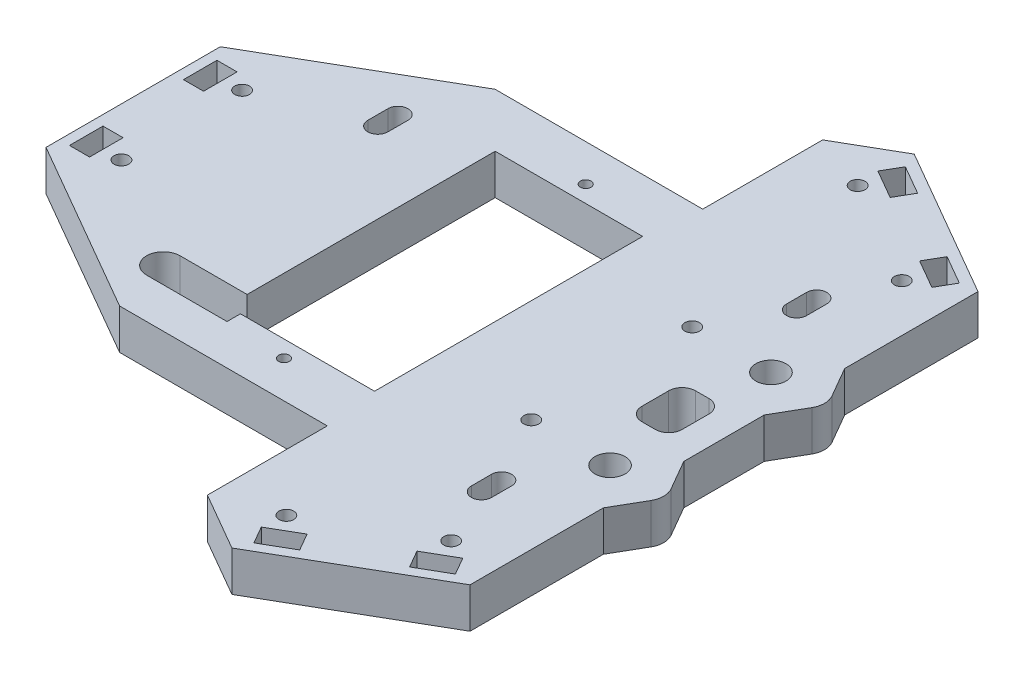
from build123d import *

# Parameters (mm, degrees)
SKETCH1_R                  = 1.1
SKETCH1_W                  = 3
SKETCH1_H                  = 5
SKETCH1_W_2                = 6
SKETCH1_H_2                = 8
BOSS_EXTRUDE1_DEPTH        = 6
F_1_6_1_6_DIAMETER_HOLE3_D = 1.6
BOSS_EXTRUDE2_DEPTH        = 6
FILLET1_R                  = 2
F_2_2_2_2_DIAMETER_HOLE1_D = 2.2
F_4_0MM_DOWEL_HOLE1_D      = 4.5


with BuildPart() as part:
    # Sketch1 → Boss-Extrude1 (new body)
    with BuildSketch(Plane(origin=(0, 0, 0), x_dir=(1, 0, 0), z_dir=(0, 1, 0))):
        Polygon((14.366669751, 50.883801944), (36.883330249, 37.883801944), (36.883330249, -37.883801944), (14.366669751, -50.883801944), (5.706415713, -45.883801944), (5.706415713, -28), (-25.269237886, -28), (-51.25, -13), (-51.25, 13), (-25.269237886, 28), (5.706415713, 28), (5.706415713, 45.883801944), align=None)
        with Locations(Location((14.205771366, 42.605117767, 0), (0, 0, 270))):
            Circle(SKETCH1_R, mode=Mode.SUBTRACT)
        with Locations(Location((29.794228634, 33.605117767, 0), (0, 0, 270))):
            Circle(SKETCH1_R, mode=Mode.SUBTRACT)
        with Locations(Location((29.794228634, -33.605117767, 0), (0, 0, 270))):
            Circle(SKETCH1_R, mode=Mode.SUBTRACT)
        with Locations(Location((14.205771366, -42.605117767, 0), (0, 0, 270))):
            Circle(SKETCH1_R, mode=Mode.SUBTRACT)
        with Locations(Location((-44, 9, 0), (0, 0, 270))):
            Circle(SKETCH1_R, mode=Mode.SUBTRACT)
        with Locations(Location((-44, -9, 0), (0, 0, 270))):
            Circle(SKETCH1_R, mode=Mode.SUBTRACT)
        with BuildLine():
            Line((4.75, -20), (-15.25, -20))
            Line((-15.25, -20), (-15.25, -22))
            Line((-15.25, -22), (-27.25, -22))
            ThreePointArc((-27.25, -22), (-29.75, -19.5), (-27.25, -17))
            Line((-27.25, -17), (-17.25, -17))
            Line((-17.25, -17), (-17.25, 20))
            Line((-17.25, 20), (4.75, 20))
            Line((4.75, 20), (4.75, -20))
        make_face(mode=Mode.SUBTRACT)
        Polygon((30.071152423, 40.084763838), (34.401279442, 37.584763838), (32.901279442, 34.986687627), (28.571152423, 37.486687627), align=None, mode=Mode.SUBTRACT)
        Polygon((15.348720558, 48.584763838), (13.848720558, 45.986687627), (18.178847577, 43.486687627), (19.678847577, 46.084763838), align=None, mode=Mode.SUBTRACT)
        Polygon((34.401279442, -37.584763838), (32.901279442, -34.986687627), (28.571152423, -37.486687627), (30.071152423, -40.084763838), align=None, mode=Mode.SUBTRACT)
        Polygon((18.178847577, -43.486687627), (19.678847577, -46.084763838), (15.348720558, -48.584763838), (13.848720558, -45.986687627), align=None, mode=Mode.SUBTRACT)
        with Locations((-48.25, -8.5)):
            Rectangle(SKETCH1_W, SKETCH1_H, mode=Mode.SUBTRACT)
        with Locations((-48.25, 8.5)):
            Rectangle(SKETCH1_W, SKETCH1_H, mode=Mode.SUBTRACT)
        with BuildLine():
            Line((-30.75, 14.5), (-30.75, 17.5))
            ThreePointArc((-30.75, 17.5), (-29.25, 19), (-27.75, 17.5))
            Line((-27.75, 17.5), (-27.75, 14.5))
            ThreePointArc((-27.75, 14.5), (-29.25, 13), (-30.75, 14.5))
        make_face(mode=Mode.SUBTRACT)
        with BuildLine():
            Line((24.206415713, -25), (24.206415713, -22))
            ThreePointArc((24.206415713, -22), (25.706415713, -20.5), (27.206415713, -22))
            Line((27.206415713, -22), (27.206415713, -25))
            ThreePointArc((27.206415713, -25), (25.706415713, -26.5), (24.206415713, -25))
        make_face(mode=Mode.SUBTRACT)
        with BuildLine():
            Line((24.206415713, 22), (24.206415713, 25))
            ThreePointArc((24.206415713, 25), (25.706415713, 26.5), (27.206415713, 25))
            Line((27.206415713, 25), (27.206415713, 22))
            ThreePointArc((27.206415713, 22), (25.706415713, 20.5), (24.206415713, 22))
        make_face(mode=Mode.SUBTRACT)
        with Locations((29.633330249, 0)):
            Rectangle(SKETCH1_W_2, SKETCH1_H_2, mode=Mode.SUBTRACT)
    extrude(amount=BOSS_EXTRUDE1_DEPTH)

    # Ø1.6 (1.6) Diameter Hole3 (through all)
    with Locations(Plane(origin=(-6.25, 0, 22.5), x_dir=(0, 0, -1), z_dir=(0, -1, 0))):
        with Locations((0, 0), (45, 0)):
            Hole(F_1_6_1_6_DIAMETER_HOLE3_D / 2)

    # Sketch9 → Boss-Extrude2 (add)
    with BuildSketch(Plane.XZ):
        with BuildLine():
            Line((36.883330249, -9), (36.883330249, -15))
            ThreePointArc((36.883330249, -15), (38.383330249, -14.598076211), (39.481406461, -13.5))
            ThreePointArc((39.481406461, -13.5), (39.883330249, -12), (39.481406461, -10.5))
            ThreePointArc((39.481406461, -10.5), (38.383330249, -9.401923789), (36.883330249, -9))
        make_face()
        with BuildLine():
            Line((36.883330249, -6), (36.883330249, -9))
            ThreePointArc((36.883330249, -9), (38.383330249, -9.401923789), (39.481406461, -10.5))
            Line((39.481406461, -10.5), (36.883330249, -6))
        make_face()
        with BuildLine():
            Line((36.883330249, -15), (36.883330249, -18))
            Line((36.883330249, -18), (39.481406461, -13.5))
            ThreePointArc((39.481406461, -13.5), (38.383330249, -14.598076211), (36.883330249, -15))
        make_face()
        with BuildLine():
            ThreePointArc((39.481406461, 10.5), (39.883330249, 12), (39.481406461, 13.5))
            ThreePointArc((39.481406461, 13.5), (38.383330249, 14.598076211), (36.883330249, 15))
            Line((36.883330249, 15), (36.883330249, 9))
            ThreePointArc((36.883330249, 9), (38.383330249, 9.401923789), (39.481406461, 10.5))
        make_face()
        with BuildLine():
            Line((36.883330249, 6), (39.481406461, 10.5))
            ThreePointArc((39.481406461, 10.5), (38.383330249, 9.401923789), (36.883330249, 9))
            Line((36.883330249, 9), (36.883330249, 6))
        make_face()
        with BuildLine():
            ThreePointArc((36.883330249, 15), (38.383330249, 14.598076211), (39.481406461, 13.5))
            Line((39.481406461, 13.5), (36.883330249, 18))
            Line((36.883330249, 18), (36.883330249, 15))
        make_face()
    extrude(amount=-BOSS_EXTRUDE2_DEPTH)

    # Fillet1
    fillet1_edges = [part.edges().sort_by_distance(p)[0] for p in [
        (32.633330249, 3, 4),
        (32.633330249, 3, -4),
        (26.633330249, 3, -4),
        (26.633330249, 3, 4),
    ]]
    fillet(fillet1_edges, radius=FILLET1_R)

    # Ø2.2 (2.2) Diameter Hole1 (through all)
    with Locations(Plane(origin=(20.133330249, 6, -12), x_dir=(0, 0, 1), z_dir=(0, 1, 0))):
        with Locations((0, 0), (24, 0)):
            Hole(F_2_2_2_2_DIAMETER_HOLE1_D / 2)

    # Ø4.0mm Dowel Hole1 (through all)
    with Locations(Plane(origin=(31.883330249, 6, -12), x_dir=(0, 0, 1), z_dir=(0, 1, 0))):
        with Locations((0, 0), (24, 0)):
            Hole(F_4_0MM_DOWEL_HOLE1_D / 2)


solid = part.part
